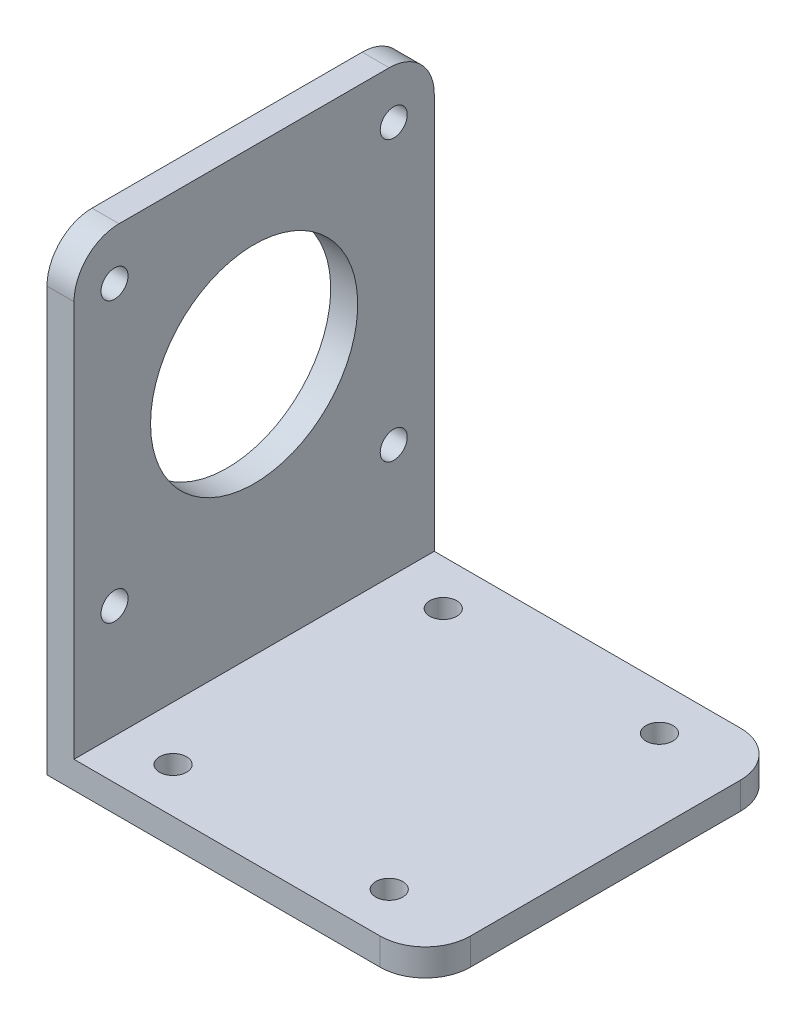
from build123d import *

# Parameters (mm, degrees)
SKETCH_1_W      = 42
SKETCH_1_H      = 40
SKETCH_1_R      = 1.5
EXTRUDE_1_DEPTH = 3
SKETCH_3_W      = 40
SKETCH_3_H      = 49
SKETCH_3_R      = 11.5
SKETCH_3_R_2    = 1.5
EXTRUDE_2_DEPTH = 3
FILLET_1_R      = 5
FILLET_2_R      = 5


with BuildPart() as part:
    # 草图1 → 凸台-拉伸1 (new body)
    with BuildSketch(Plane(origin=(0, 0, 0), x_dir=(1, 0, 0), z_dir=(0, 1, 0))):
        Rectangle(SKETCH_1_W, SKETCH_1_H)
        with Locations(Location((-12, 15, 0), (0, 0, 270))):
            Circle(SKETCH_1_R, mode=Mode.SUBTRACT)
        with Locations(Location((-12, -15, 0), (0, 0, 90))):
            Circle(SKETCH_1_R, mode=Mode.SUBTRACT)
        with Locations(Location((12, -15, 0), (0, 0, 270))):
            Circle(SKETCH_1_R, mode=Mode.SUBTRACT)
        with Locations(Location((12, 15, 0), (0, 0, 90))):
            Circle(SKETCH_1_R, mode=Mode.SUBTRACT)
    extrude(amount=EXTRUDE_1_DEPTH)

    # 草图3 → 凸台-拉伸2 (add)
    with BuildSketch(Plane.ZY.offset(21)):
        with Locations((0, 27.5)):
            Rectangle(SKETCH_3_W, SKETCH_3_H)
        with Locations((0, 31)):
            Circle(SKETCH_3_R, mode=Mode.SUBTRACT)
        with Locations((-15.5, 46.5)):
            Circle(SKETCH_3_R_2, mode=Mode.SUBTRACT)
        with Locations((-15.5, 15.5)):
            Circle(SKETCH_3_R_2, mode=Mode.SUBTRACT)
        with Locations(Location((15.5, 15.5, 0), (0, 0, 180))):
            Circle(SKETCH_3_R_2, mode=Mode.SUBTRACT)
        with Locations(Location((15.5, 46.5, 0), (0, 0, 180))):
            Circle(SKETCH_3_R_2, mode=Mode.SUBTRACT)
    extrude(amount=-EXTRUDE_2_DEPTH)

    # 圆角1
    fillet_1_edges = [part.edges().sort_by_distance(p)[0] for p in [
        (-19.5, 52, -20),
        (-19.5, 52, 20),
    ]]
    fillet(fillet_1_edges, radius=FILLET_1_R)

    # 圆角2
    fillet_2_edges = [part.edges().sort_by_distance(p)[0] for p in [
        (21, 1.5, 20),
        (21, 1.5, -20),
    ]]
    fillet(fillet_2_edges, radius=FILLET_2_R)


solid = part.part
